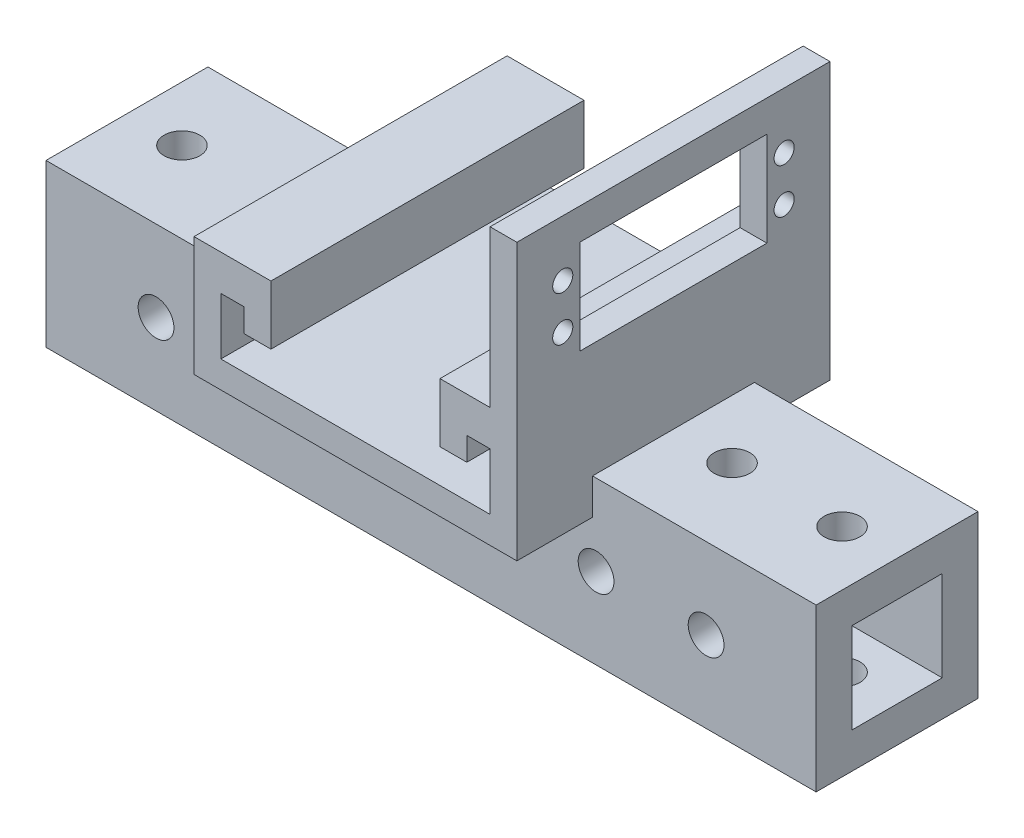
from build123d import *

# Parameters (mm, degrees)
BOSS_EXTRUDE1_DEPTH  = 70
SKETCH2_R            = 2.25
SKETCH2_W            = 41.8
SKETCH2_H            = 21.1
CUT_EXTRUDE1_DEPTH   = 6
LPATTERN1_COUNT      = 4
LPATTERN1_PITCH      = 14
LPATTERN1_COUNT_DIR2 = 2
LPATTERN1_PITCH_DIR2 = 55
SKETCH4_W            = 36.2
SKETCH4_H            = 8
BOSS_EXTRUDE2_DEPTH  = 50
SKETCH5_W            = 36.2
SKETCH5_H            = 8
BOSS_EXTRUDE3_DEPTH  = 50
SKETCH6_W            = 172.2
SKETCH6_H            = 8
BOSS_EXTRUDE4_DEPTH  = 20.2
SKETCH7_W            = 172.2
SKETCH7_H            = 36.2
BOSS_EXTRUDE5_DEPTH  = 8
SKETCH8_R            = 4
CUT_EXTRUDE2_DEPTH   = 147.830991279
LPATTERN2_COUNT      = 6
LPATTERN2_PITCH      = 24.6
SKETCH9_R            = 4
CUT_EXTRUDE3_DEPTH   = 151.720038482


with BuildPart() as part:
    # Sketch1 → Boss-Extrude1 (new body)
    with BuildSketch(Plane.XY):
        Polygon((0, 26.7), (0, 0), (72.2, 0), (72.2, 61.7), (66.2, 61.7), (66.2, 26.7), (55, 26.7), (55, 13.5), (61, 13.5), (61, 18.7), (66.2, 18.7), (66.2, 6), (6, 6), (6, 18.7), (11.2, 18.7), (11.2, 13.5), (17.2, 13.5), (17.2, 26.7), align=None)
    extrude(amount=BOSS_EXTRUDE1_DEPTH)

    # Sketch2 → Cut-Extrude1 (cut)
    with BuildSketch(Plane.ZY.offset(-66.2)):
        with Locations(Location((10.25, 49.13, 0), (0, 0, 270))):
            Circle(SKETCH2_R)
        with Locations(Location((10.25, 39.13, 0), (0, 0, 270))):
            Circle(SKETCH2_R)
        with Locations(Location((59.75, 49.13, 0), (0, 0, 270))):
            Circle(SKETCH2_R)
        with Locations(Location((59.75, 39.13, 0), (0, 0, 270))):
            Circle(SKETCH2_R)
        with Locations((35, 44.13)):
            Rectangle(SKETCH2_W, SKETCH2_H)
    extrude(amount=-CUT_EXTRUDE1_DEPTH, mode=Mode.SUBTRACT)

    # Sketch3 → Cut-Revolve1 (revolve, cut)
    with BuildSketch(Plane.XZ.offset(-18.7)):
        with BuildLine():
            Line((61.1, 56), (66.1, 56))
            ThreePointArc((66.1, 56), (63.6, 58.5), (61.1, 56))
        make_face()
    cut_revolve1 = revolve(axis=Axis((61.1, 18.7, 56), (1, 0, 0)), mode=Mode.SUBTRACT)

    # LPattern1: Cut-Revolve1 4 × 2
    with Locations(*[(-j * LPATTERN1_PITCH_DIR2, 0, -i * LPATTERN1_PITCH) for i in range(LPATTERN1_COUNT) for j in range(LPATTERN1_COUNT_DIR2) if (i, j) != (0, 0)]):
        add(cut_revolve1, mode=Mode.SUBTRACT)

    # Sketch4 → Boss-Extrude2 (add)
    with BuildSketch(Plane(origin=(72.2, 0, 0), x_dir=(0, 0, -1), z_dir=(1, 0, 0))):
        with Locations((-35, 4)):
            Rectangle(SKETCH4_W, SKETCH4_H)
    extrude(amount=BOSS_EXTRUDE2_DEPTH)

    # Sketch5 → Boss-Extrude3 (add)
    with BuildSketch(Plane.ZY):
        with Locations((35, 4)):
            Rectangle(SKETCH5_W, SKETCH5_H)
    extrude(amount=BOSS_EXTRUDE3_DEPTH)

    # Sketch6 → Boss-Extrude4 (add)
    with BuildSketch(Plane.XZ):
        with Locations((36.1, 49.1)):
            Rectangle(SKETCH6_W, SKETCH6_H)
        with Locations((36.1, 20.9)):
            Rectangle(SKETCH6_W, SKETCH6_H)
    extrude(amount=BOSS_EXTRUDE4_DEPTH)

    # Sketch7 → Boss-Extrude5 (add)
    with BuildSketch(Plane.XZ.offset(20.2)):
        with Locations((36.1, 35)):
            Rectangle(SKETCH7_W, SKETCH7_H)
    extrude(amount=BOSS_EXTRUDE5_DEPTH)

    # Sketch8 → Cut-Extrude2 (cut, through all)
    with BuildSketch(Plane.XY.offset(53.1)):
        with Locations((-25.4, -10.1)):
            Circle(SKETCH8_R)
    cut_extrude2 = extrude(amount=-CUT_EXTRUDE2_DEPTH, mode=Mode.SUBTRACT)

    # LPattern2: Cut-Extrude2 ×6
    with Locations(*[(i * LPATTERN2_PITCH, 0, 0) for i in range(1, LPATTERN2_COUNT)]):
        add(cut_extrude2, mode=Mode.SUBTRACT)

    # Sketch9 → Cut-Extrude3 (cut, through all)
    with BuildSketch(Plane(origin=(0, 8, 0), x_dir=(1, 0, 0), z_dir=(0, 1, 0))):
        with Locations(Location((-37.7, -35, 0), (0, 0, 180))):
            Circle(SKETCH9_R)
        with Locations(Location((-13.1, -35, 0), (0, 0, 180))):
            Circle(SKETCH9_R)
    cut_extrude3 = extrude(amount=-CUT_EXTRUDE3_DEPTH, mode=Mode.SUBTRACT)

    # Mirror1: Cut-Extrude3 across plane
    add(cut_extrude3.mirror(Plane.ZY.offset(-36.1)), mode=Mode.SUBTRACT)


solid = part.part
